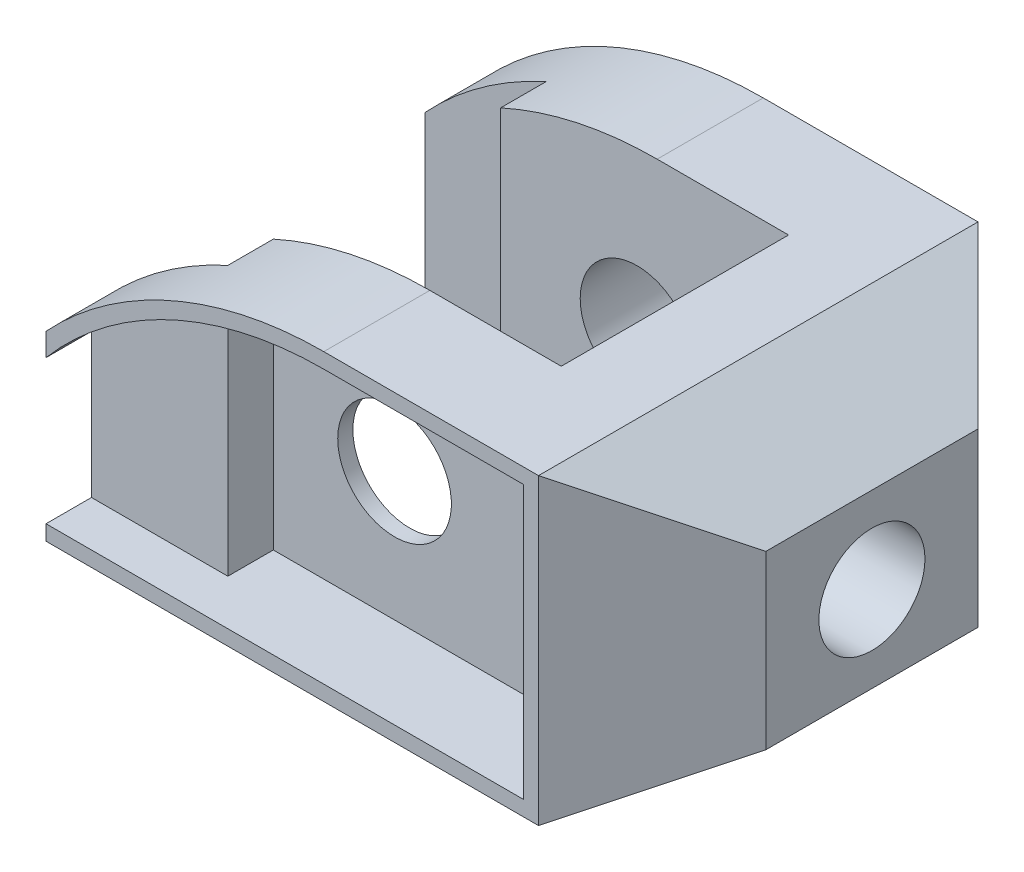
from build123d import *

# Parameters (mm, degrees)
ESQUISSE1_R             = 7.5
BOSS_EXTRU_1_DEPTH      = 58
ENL_V_MAT_EXTRU_1_DEPTH = 107.60206377
ENL_V_MAT_EXTRU_2_DEPTH = 107.60206377
ESQUISSE6_R             = 7
ENL_V_MAT_EXTRU_3_DEPTH = 107.60206377
ENL_V_MAT_EXTRU_4_DEPTH = 12
ENL_V_MAT_EXTRU_5_DEPTH = 6


with BuildPart() as part:
    # Esquisse1 → Boss.-Extru.1 (new body)
    with BuildSketch(Plane.XY):
        with BuildLine():
            Line((0, 0), (0, 24))
            ThreePointArc((0, 24), (16.66060556, 35.82575695), (36.66060556, 40))
            Line((36.66060556, 40), (65, 40))
            Line((65, 40), (80, 31.339745962))
            Line((80, 31.339745962), (80, 8.660254038))
            Line((80, 8.660254038), (65, 0))
            Line((65, 0), (0, 0))
        make_face()
        with Locations(Location((34, 19, 0), (0, 0, 180))):
            Circle(ESQUISSE1_R, mode=Mode.SUBTRACT)
    extrude(amount=BOSS_EXTRU_1_DEPTH)

    # Esquisse3 → Enlèv. mat.-Extru.1 (cut, through all)
    with BuildSketch(Plane.XZ):
        Polygon((0, 50), (16, 50), (16, 44), (54, 44), (54, 14), (16, 14), (16, 8), (0, 8), align=None)
    extrude(amount=-ENL_V_MAT_EXTRU_1_DEPTH, mode=Mode.SUBTRACT)

    # Esquisse5 → Enlèv. mat.-Extru.2 (cut, through all)
    with BuildSketch(Plane(origin=(0, 40, 0), x_dir=(1, 0, 0), z_dir=(0, 1, 0))):
        Polygon((65, 0), (80, 0), (80, -15), align=None)
        Polygon((65, -58), (80, -58), (80, -43), align=None)
    extrude(amount=-ENL_V_MAT_EXTRU_2_DEPTH, mode=Mode.SUBTRACT)

    # Esquisse6 → Enlèv. mat.-Extru.3 (cut, through all)
    with BuildSketch(Plane(origin=(80, 0, 0), x_dir=(0, 0, -1), z_dir=(1, 0, 0))):
        with Locations((-29, 20)):
            Circle(ESQUISSE6_R)
    extrude(amount=-ENL_V_MAT_EXTRU_3_DEPTH, mode=Mode.SUBTRACT)

    # Esquisse7 → Enlèv. mat.-Extru.4 (cut)
    with BuildSketch(Plane.XY.offset(58)):
        with BuildLine():
            Line((18, 34.224221872), (18, 2))
            Line((18, 2), (63, 2))
            Line((63, 2), (63, 38))
            Line((63, 38), (36.66060556, 38))
            ThreePointArc((36.66060556, 38), (27.141221384, 37.046586751), (18, 34.224221872))
        make_face()
    extrude(amount=-ENL_V_MAT_EXTRU_4_DEPTH, mode=Mode.SUBTRACT)

    # Esquisse8 → Enlèv. mat.-Extru.5 (cut)
    with BuildSketch(Plane.XY.offset(58)):
        with BuildLine():
            Line((-4.664676722, 2), (-4.664676722, 14.417637977))
            ThreePointArc((-4.664676722, 14.417637977), (5.074977872, 26.143438182), (18, 34.224221872))
            Line((18, 34.224221872), (18, 2))
            Line((18, 2), (-4.664676722, 2))
        make_face()
    extrude(amount=-ENL_V_MAT_EXTRU_5_DEPTH, mode=Mode.SUBTRACT)


solid = part.part
